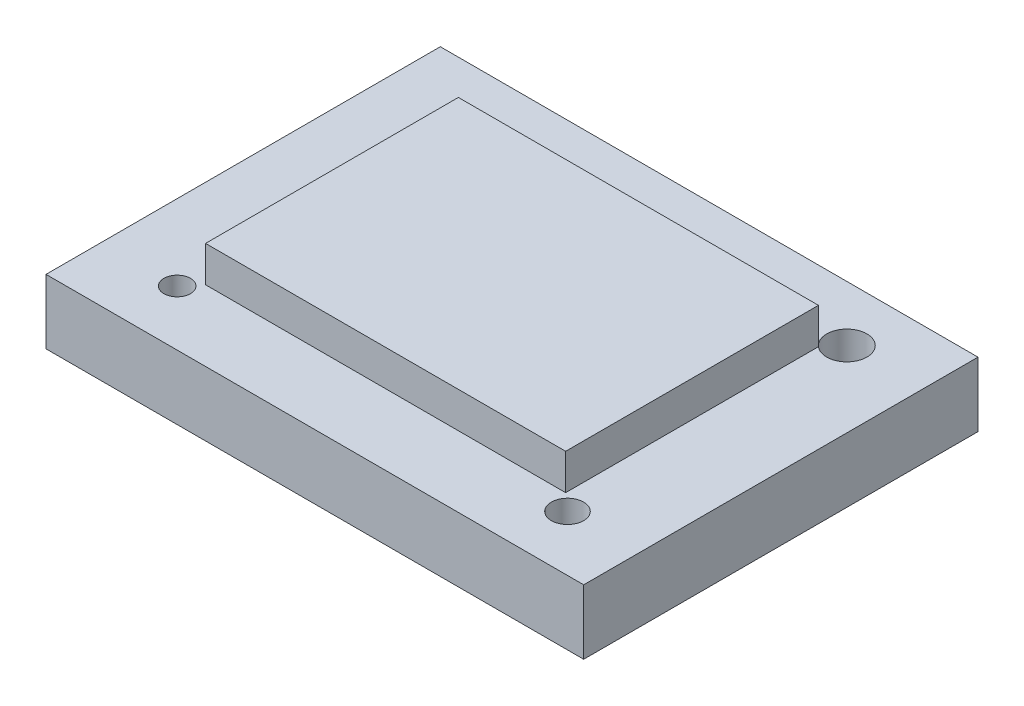
from build123d import *

# Parameters (mm, degrees)
F_01_BASE_PROFILE_W           = 150
F_01_BASE_PROFILE_H           = 110
F_01_BASE_PROFILE_R           = 3.711604984
F_01_BASE_PROFILE_R_2         = 4.5
F_01_BASE_PROFILE_R_3         = 1.223591395
F_01_BASE_PROFILE_R_4         = 5.612716763
F_01_BASE_PROFILE_W_2         = 70
F_01_BASE_PROFILE_H_2         = 24
F_01_BASE_EXTRUDE_DEPTH       = 18
F_02_BOSS_PROFILE_W           = 100.452577252
F_02_BOSS_PROFILE_H           = 70.52593178
F_02_REINFORCEMENT_BOSS_DEPTH = 28


with BuildPart() as part:
    # 01_Base_Profile → 01_Base_Extrude (new body)
    with BuildSketch(Plane(origin=(0, 0, 0), x_dir=(1, 0, 0), z_dir=(0, 1, 0))):
        Rectangle(F_01_BASE_PROFILE_W, F_01_BASE_PROFILE_H)
        with Locations(Location((-53.887283237, -39.51734104, 0), (0, 0, 270))):
            Circle(F_01_BASE_PROFILE_R, mode=Mode.SUBTRACT)
        with Locations(Location((55, -39.51734104, 0), (0, 0, 270))):
            Circle(F_01_BASE_PROFILE_R_2, mode=Mode.SUBTRACT)
        with Locations(Location((-53.887283237, 38, 0), (0, 0, 270))):
            Circle(F_01_BASE_PROFILE_R_3, mode=Mode.SUBTRACT)
        with Locations(Location((53.887283237, 39.51734104, 0), (0, 0, 270))):
            Circle(F_01_BASE_PROFILE_R_4, mode=Mode.SUBTRACT)
        Rectangle(F_01_BASE_PROFILE_W_2, F_01_BASE_PROFILE_H_2, mode=Mode.SUBTRACT)
    extrude(amount=F_01_BASE_EXTRUDE_DEPTH)

    # 02_Boss_Profile → 02_Reinforcement_Boss (add)
    with BuildSketch(Plane(origin=(0, 0, 0), x_dir=(1, 0, 0), z_dir=(0, 1, 0))):
        Rectangle(F_02_BOSS_PROFILE_W, F_02_BOSS_PROFILE_H)
    extrude(amount=F_02_REINFORCEMENT_BOSS_DEPTH)


solid = part.part
